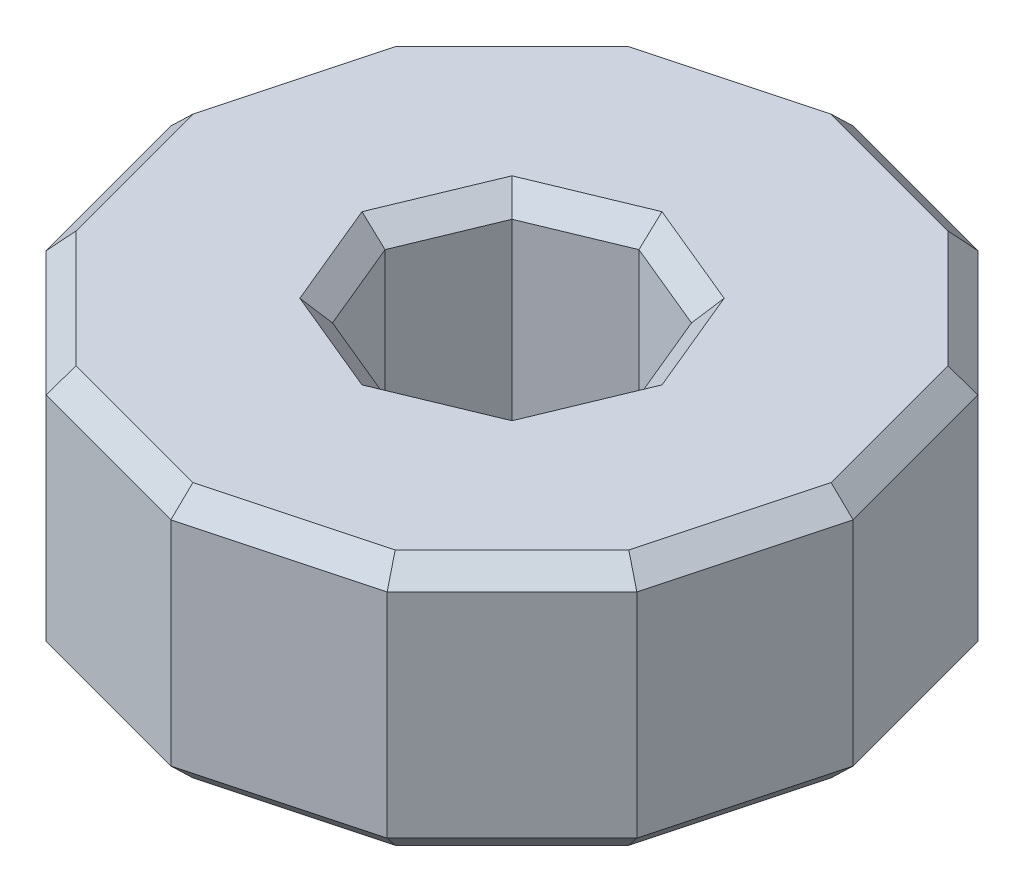
from build123d import *

# Parameters (mm, degrees)
BOSS_EXTRUDE1_DEPTH = 6
CHAMFER1_SIZE       = 0.5


with BuildPart() as part:
    # Sketch1 → Boss-Extrude1 (new body)
    with BuildSketch(Plane(origin=(0, 0, 0), x_dir=(1, 0, 0), z_dir=(0, 1, 0))):
        Polygon((8, 0), (6.92820323, 4), (4, 6.92820323), (0, 8), (-4, 6.92820323), (-6.92820323, 4), (-8, 0), (-6.92820323, -4), (-4, -6.92820323), (0, -8), (4, -6.92820323), (6.92820323, -4), align=None)
        Polygon((2.976578551, 0), (2.104758878, 2.104758878), (0, 2.976578551), (-2.104758878, 2.104758878), (-2.976578551, 0), (-2.104758878, -2.104758878), (0, -2.976578551), (2.104758878, -2.104758878), align=None, mode=Mode.SUBTRACT)
    extrude(amount=BOSS_EXTRUDE1_DEPTH)

    # Chamfer1
    chamfer1_edges = [part.edges().sort_by_distance(p)[0] for p in [
        (5.464101615, 6, -5.464101615),
        (5.464101615, 0, 5.464101615),
        (2, 0, 7.464101615),
        (-2, 0, 7.464101615),
        (-5.464101615, 0, 5.464101615),
        (-7.464101615, 0, 2),
        (-7.464101615, 0, -2),
        (2, 6, -7.464101615),
        (-5.464101615, 0, -5.464101615),
        (-2, 0, -7.464101615),
        (2, 0, -7.464101615),
        (5.464101615, 0, -5.464101615),
        (7.464101615, 0, -2),
        (7.464101615, 0, 2),
        (-2, 6, -7.464101615),
        (-5.464101615, 6, -5.464101615),
        (-7.464101615, 6, -2),
        (-7.464101615, 6, 2),
        (-5.464101615, 6, 5.464101615),
        (-2, 6, 7.464101615),
        (2, 6, 7.464101615),
        (2.540668714, 0, 1.052379439),
        (2.540668714, 0, -1.052379439),
        (1.052379439, 0, -2.540668714),
        (-1.052379439, 0, -2.540668714),
        (5.464101615, 6, 5.464101615),
        (-2.540668714, 0, -1.052379439),
        (-2.540668714, 0, 1.052379439),
        (-1.052379439, 0, 2.540668714),
        (1.052379439, 0, 2.540668714),
        (2.540668714, 6, 1.052379439),
        (2.540668714, 6, -1.052379439),
        (1.052379439, 6, -2.540668714),
        (-1.052379439, 6, -2.540668714),
        (7.464101615, 6, 2),
        (-2.540668714, 6, -1.052379439),
        (-2.540668714, 6, 1.052379439),
        (-1.052379439, 6, 2.540668714),
        (1.052379439, 6, 2.540668714),
        (7.464101615, 6, -2),
    ]]
    chamfer(chamfer1_edges, length=CHAMFER1_SIZE)


solid = part.part
